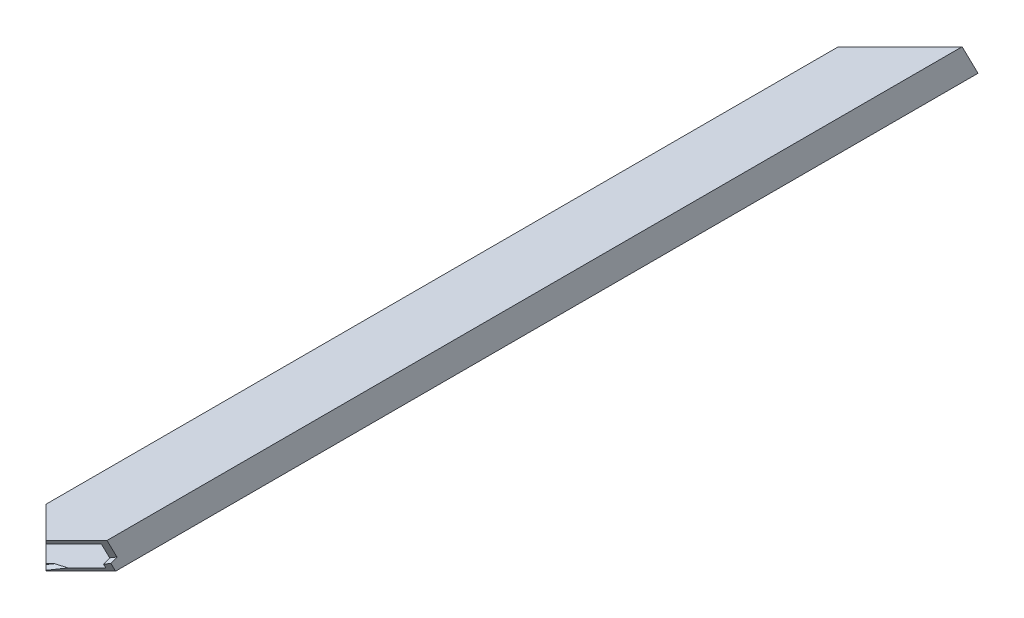
from build123d import *

# Parameters (mm, degrees)
SKETCH1_W           = 50.8
SKETCH1_H           = 25.4
SKETCH1_W_2         = 44.45
SKETCH1_H_2         = 19.05
BOSS_EXTRUDE1_DEPTH = 771.9314
CUT_EXTRUDE1_DEPTH  = 773.76672179
CUT_EXTRUDE4_DEPTH  = 754.3292
CUT_EXTRUDE5_DEPTH  = 4.0132
SKETCH9_W           = 50.8
SKETCH9_H           = 21.0312
CUT_EXTRUDE7_DEPTH  = 16.8656
SKETCH10_W          = 77.733567683
SKETCH10_H          = 129.906903396
CUT_EXTRUDE8_DEPTH  = 40.64


with BuildPart() as part:
    # Sketch1 → Boss-Extrude1 (new body)
    with BuildSketch(Plane.XY):
        Rectangle(SKETCH1_W, SKETCH1_H)
        Rectangle(SKETCH1_W_2, SKETCH1_H_2, mode=Mode.SUBTRACT)
    extrude(amount=BOSS_EXTRUDE1_DEPTH)

    # Sketch2 → Cut-Extrude1 (cut, through all)
    with BuildSketch(Plane(origin=(0, 12.7, 0), x_dir=(1, 0, 0), z_dir=(0, 1, 0))):
        Polygon((25.4, 0), (-25.4, -50.8), (-25.4, 0), align=None)
        Polygon((-25.4, -771.9314), (25.4, -721.1314), (25.4, -771.9314), align=None)
    extrude(amount=-CUT_EXTRUDE1_DEPTH, mode=Mode.SUBTRACT)

    # Sketch5 → Cut-Extrude4 (cut)
    with BuildSketch(Plane(origin=(12.7, 0, -12.7), x_dir=(0, 1, 0), z_dir=(-0.7071067811865409, 0, 0.7071067811865541))):
        Polygon((12.7, -17.960512242), (12.7, -27.205356192), (-12.7, -17.960512242), align=None)
        Polygon((12.7, -527.877415309), (-12.7, -518.632571358), (-12.7, -527.877415309), align=None)
    extrude(amount=CUT_EXTRUDE4_DEPTH, mode=Mode.SUBTRACT)

    # Sketch7 → Cut-Extrude5 (cut)
    with BuildSketch(Plane(origin=(326.715708963, -168.170913211, 326.715708963), x_dir=(0.5736482337991444, -0.3364323186524704, -0.7468205934662252), z_dir=(0.6644630243886818, -0.3420201433256654, 0.6644630243886694))):
        Polygon((-595.337621849, -22.133397874), (-492.868446349, 40.706054593), (-475.594227989, 12.537844285), (-578.063403489, -50.301608182), align=None)
    extrude(amount=-CUT_EXTRUDE5_DEPTH, mode=Mode.SUBTRACT)

    # Sketch9 → Cut-Extrude7 (cut, symmetric)
    with BuildSketch(Plane(origin=(0, 0, 0), x_dir=(1, 0, 0), z_dir=(0, 1, 0))):
        with Locations((0, -755.37603578)):
            Rectangle(SKETCH9_W, SKETCH9_H)
    extrude(amount=CUT_EXTRUDE7_DEPTH, both=True, mode=Mode.SUBTRACT)

    # Sketch10 → Cut-Extrude8 (cut)
    with BuildSketch(Plane(origin=(-369.87845504, 0, 369.87845504), x_dir=(-0.7071067811865528, 0, -0.7071067811865422), z_dir=(0.7071067811865422, 0, -0.7071067811865528))):
        with Locations((-488.130578971, 23.675993241)):
            Rectangle(SKETCH10_W, SKETCH10_H)
    extrude(amount=-CUT_EXTRUDE8_DEPTH, mode=Mode.SUBTRACT)


solid = part.part
